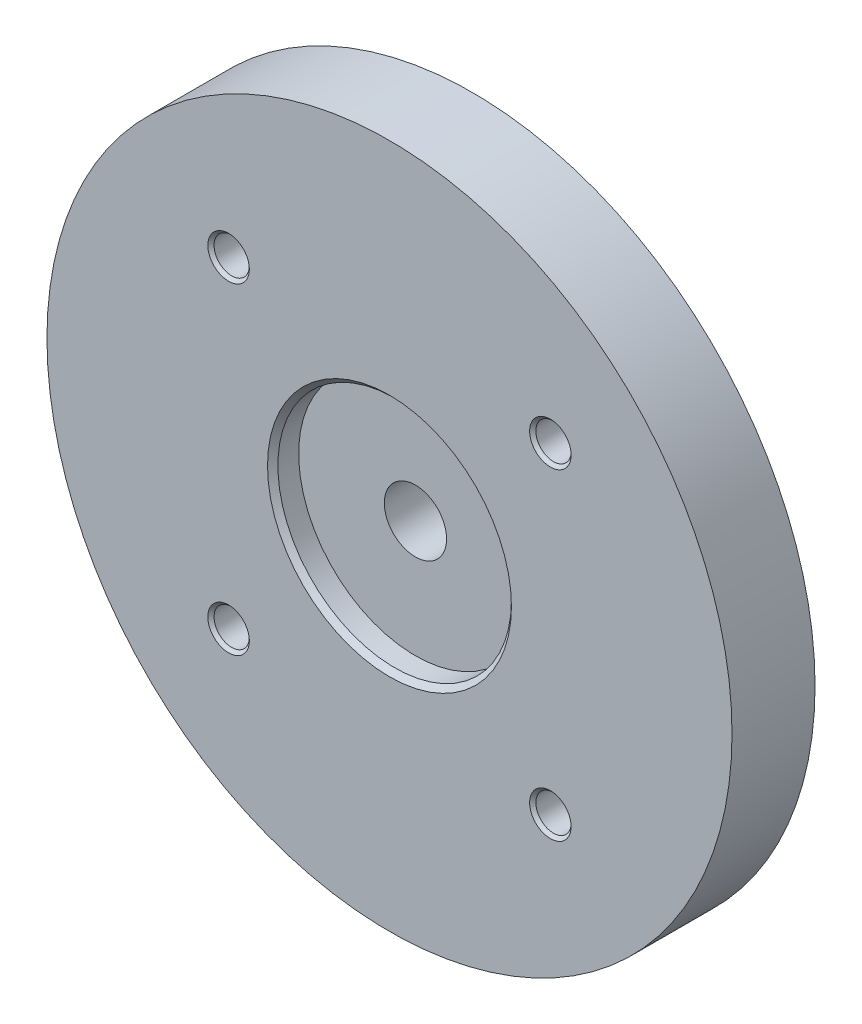
from build123d import *

# Parameters (mm, degrees)
SKETCH2_R               = 33
BOSS_EXTRUDE1_DEPTH     = 8
SKETCH6_R               = 10
BOSS_EXTRUDE2_DEPTH     = 2
CUT_EXTRUDE1_DEPTH      = 48.728398255
CUT_EXTRUDE1_DEPTH_BACK = 48.728398255
SKETCH3_R               = 1.7
SKETCH3_R_2             = 3
CUT_EXTRUDE2_DEPTH      = 48.349762407
CUT_EXTRUDE2_DEPTH_BACK = 2
SKETCH4_R               = 2.8
SKETCH5_R               = 2.1
CUT_EXTRUDE3_DEPTH      = 6
FILLET1_R               = 1
SKETCH7_R               = 11.25
CUT_EXTRUDE4_DEPTH      = 2.5
CHAMFER1_SIZE           = 0.5
CHAMFER2_SIZE           = 0.3


with BuildPart() as part:
    # Sketch2 → Boss-Extrude1 (new body)
    with BuildSketch(Plane.XY):
        Circle(SKETCH2_R)
    extrude(amount=BOSS_EXTRUDE1_DEPTH)

    # Sketch6 → Boss-Extrude2 (add)
    with BuildSketch(Plane(origin=(0, 0, 0), x_dir=(-1, 0, 0), z_dir=(0, 0, -1))):
        Circle(SKETCH6_R)
    extrude(amount=BOSS_EXTRUDE2_DEPTH)

    # Sketch3 → Cut-Extrude1 (cut, two sides: drawn at the far end of the back side and taken through both)
    with BuildSketch(Plane.XY.offset(8).offset(-CUT_EXTRUDE1_DEPTH_BACK)):
        with Locations((-15.5, 15.5)):
            Circle(SKETCH3_R)
        with Locations((15.5, 15.5)):
            Circle(SKETCH3_R)
        with Locations((15.5, -15.5)):
            Circle(SKETCH3_R)
        with Locations((-15.5, -15.5)):
            Circle(SKETCH3_R)
        Circle(SKETCH3_R_2)
    extrude(amount=CUT_EXTRUDE1_DEPTH + CUT_EXTRUDE1_DEPTH_BACK, mode=Mode.SUBTRACT)

    # Sketch4 → Cut-Extrude2 (cut, two sides: drawn at the far end of the back side and taken through both)
    with BuildSketch(Plane(origin=(0, 0, 0), x_dir=(-1, 0, 0), z_dir=(0, 0, -1)).offset(-CUT_EXTRUDE2_DEPTH_BACK)):
        with Locations(Location((-15.5, 15.5, 0), (0, 0, 180))):
            Circle(SKETCH4_R)
        with Locations(Location((15.5, 15.5, 0), (0, 0, 180))):
            Circle(SKETCH4_R)
        with Locations(Location((15.5, -15.5, 0), (0, 0, 180))):
            Circle(SKETCH4_R)
        with Locations(Location((-15.5, -15.5, 0), (0, 0, 180))):
            Circle(SKETCH4_R)
    extrude(amount=CUT_EXTRUDE2_DEPTH + CUT_EXTRUDE2_DEPTH_BACK, mode=Mode.SUBTRACT)

    # Sketch5 → Cut-Extrude3 (cut)
    with BuildSketch(Plane(origin=(0, 0, 0), x_dir=(-1, 0, 0), z_dir=(0, 0, -1))):
        with Locations((0, 29.5)):
            Circle(SKETCH5_R)
        with Locations((29.5, 0)):
            Circle(SKETCH5_R)
        with Locations((0, -29.5)):
            Circle(SKETCH5_R)
        with Locations((-29.5, 0)):
            Circle(SKETCH5_R)
    extrude(amount=-CUT_EXTRUDE3_DEPTH, mode=Mode.SUBTRACT)

    # Fillet1
    fillet1_edges = [part.edges().sort_by_distance(p)[0] for p in [
        (10, 0, 0),
    ]]
    fillet(fillet1_edges, radius=FILLET1_R)

    # Sketch7 → Cut-Extrude4 (cut)
    with BuildSketch(Plane.XY.offset(8)):
        Circle(SKETCH7_R)
    extrude(amount=-CUT_EXTRUDE4_DEPTH, mode=Mode.SUBTRACT)

    # Chamfer1
    chamfer1_edges = [part.edges().sort_by_distance(p)[0] for p in [
        (-11.25, 0, 8),
    ]]
    chamfer(chamfer1_edges, length=CHAMFER1_SIZE)

    # Chamfer2
    chamfer2_edges = [part.edges().sort_by_distance(p)[0] for p in [
        (-17.2, -15.5, 8),
        (13.8, -15.5, 8),
        (13.8, 15.5, 8),
        (-17.2, 15.5, 8),
    ]]
    chamfer(chamfer2_edges, length=CHAMFER2_SIZE)


solid = part.part
